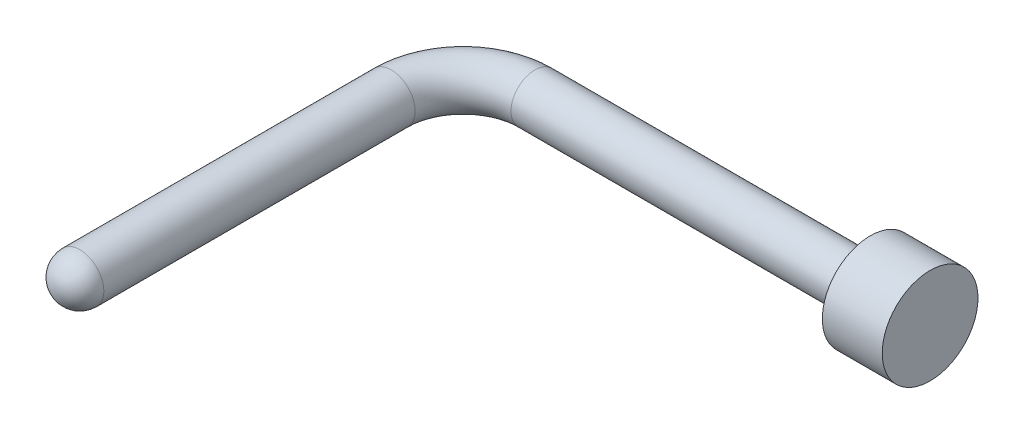
from build123d import *

# Parameters (mm, degrees)
SKETCH2_R           = 1
FILLET1_R           = 1
SKETCH3_R           = 2
BOSS_EXTRUDE1_DEPTH = 2.5


with BuildPart() as part:
    # Sweep2: sweep along a path in Sketch1
    with BuildLine(Plane(origin=(0, 0, 0), x_dir=(1, 0, 0), z_dir=(0, 1, 0))) as sweep2_path:
        Line((0, -17), (0, -3))
        ThreePointArc((0, -3), (0.878679656, -0.878679656), (3, 0))
        Line((3, 0), (17, 0))
    # Sketch2 → Sweep2 (sweep)
    with BuildSketch(Plane(origin=(17, 0, 0), x_dir=(0, 0, -1), z_dir=(1, 0, 0))):
        Circle(SKETCH2_R)
    sweep(path=sweep2_path.line)

    # Fillet1
    fillet1_edges = [part.edges().sort_by_distance(p)[0] for p in [
        (1, 0, 17),
    ]]
    fillet(fillet1_edges, radius=FILLET1_R)

    # Sketch3 → Boss-Extrude1 (add)
    with BuildSketch(Plane(origin=(17, 0, 0), x_dir=(0, 0, -1), z_dir=(1, 0, 0))):
        Circle(SKETCH3_R)
    extrude(amount=BOSS_EXTRUDE1_DEPTH)


solid = part.part
